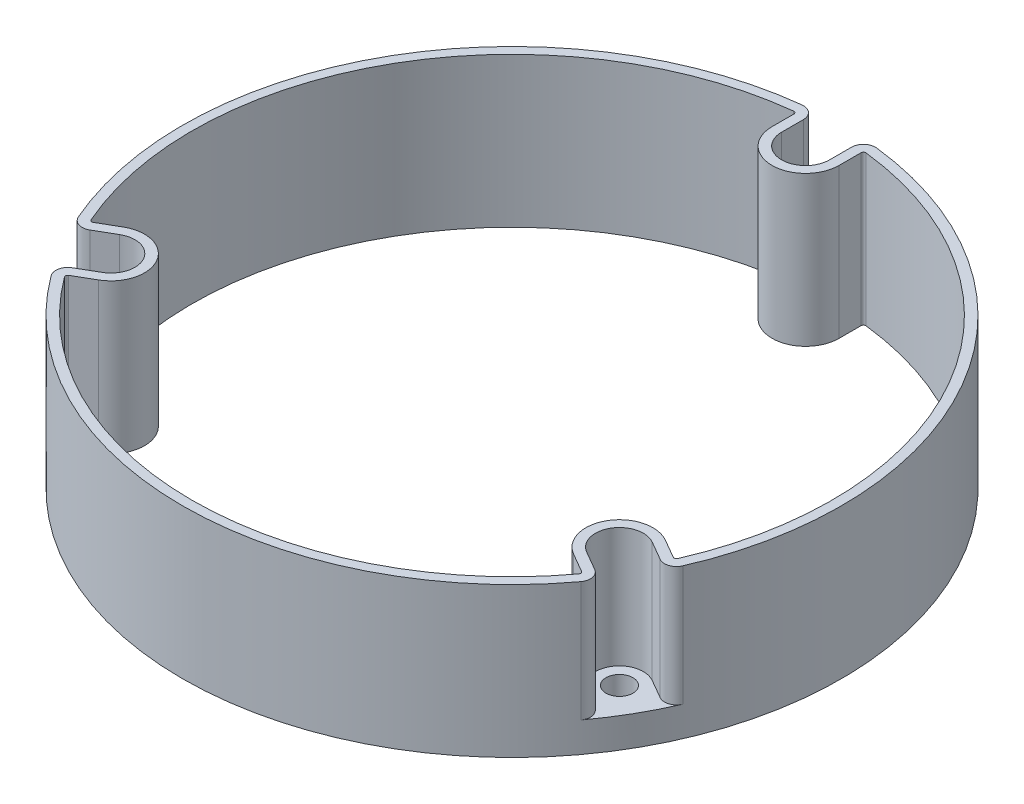
from build123d import *
from build123d.topology import SkipClean

# Parameters (mm, degrees)
EXTRUDE_THIN1_DEPTH = 25
SKETCH3_R           = 2.25
BOSS_EXTRUDE1_DEPTH = 5


with BuildPart() as part:
    # Sketch2 → Extrude-Thin1 (new body)
    with BuildSketch(Plane(origin=(0, 0, 0), x_dir=(1, 0, 0), z_dir=(0, 1, 0))):
        with BuildLine():
            Line((-4, 52.659282183), (-4, 49))
            ThreePointArc((-4, 49), (0, 45), (4, 49))
            Line((4, 49), (4, 52.659282183))
            ThreePointArc((4, 52.659282183), (4.668239922, 54.151399837), (6.226415094, 54.646424907))
            ThreePointArc((6.226415094, 54.646424907), (47.631397208, 27.5), (50.438399742, -21.930978807))
            ThreePointArc((50.438399742, -21.930978807), (49.23060787, -23.032885555), (47.604276115, -22.865539476))
            Line((47.604276115, -22.865539476), (44.435244785, -21.035898385))
            ThreePointArc((44.435244785, -21.035898385), (38.97114317, -22.5), (40.435244785, -27.964101615))
            Line((40.435244785, -27.964101615), (43.604276115, -29.793742707))
            ThreePointArc((43.604276115, -29.793742707), (44.562367948, -31.118514282), (44.211984648, -32.7154461))
            ThreePointArc((44.211984648, -32.7154461), (0, -55), (-44.211984648, -32.715446099))
            ThreePointArc((-44.211984648, -32.715446099), (-44.562367948, -31.118514282), (-43.604276115, -29.793742706))
            Line((-43.604276115, -29.793742706), (-40.435244785, -27.964101615))
            ThreePointArc((-40.435244785, -27.964101615), (-38.97114317, -22.5), (-44.435244785, -21.035898385))
            Line((-44.435244785, -21.035898385), (-47.604276115, -22.865539476))
            ThreePointArc((-47.604276115, -22.865539476), (-49.23060787, -23.032885555), (-50.438399742, -21.930978807))
            ThreePointArc((-50.438399742, -21.930978807), (-47.631397208, 27.5), (-6.226415094, 54.646424907))
            ThreePointArc((-6.226415094, 54.646424907), (-4.668239922, 54.151399837), (-4, 52.659282183))
        make_face()
        with BuildLine():
            Line((-5.6, 52.659282183), (-5.6, 49))
            ThreePointArc((-5.6, 49), (0, 43.4), (5.6, 49))
            Line((5.6, 49), (5.6, 52.659282183))
            ThreePointArc((5.6, 52.659282183), (5.733647984, 52.957705714), (6.045283019, 53.056710728))
            ThreePointArc((6.045283019, 53.056710728), (46.245756562, 26.7), (48.971100841, -21.292986696))
            ThreePointArc((48.971100841, -21.292986696), (48.729542466, -21.513368046), (48.404276115, -21.47989883))
            Line((48.404276115, -21.47989883), (45.235244785, -19.650257739))
            ThreePointArc((45.235244785, -19.650257739), (37.585502524, -21.7), (39.635244785, -29.349742261))
            Line((39.635244785, -29.349742261), (42.804276115, -31.179383353))
            ThreePointArc((42.804276115, -31.179383353), (42.995894482, -31.444337668), (42.925817822, -31.763724031))
            ThreePointArc((42.925817822, -31.763724031), (0, -53.4), (-42.925817822, -31.763724031))
            ThreePointArc((-42.925817822, -31.763724031), (-42.995894482, -31.444337668), (-42.804276115, -31.179383353))
            Line((-42.804276115, -31.179383353), (-39.635244785, -29.349742261))
            ThreePointArc((-39.635244785, -29.349742261), (-37.585502524, -21.7), (-45.235244785, -19.650257739))
            Line((-45.235244785, -19.650257739), (-48.404276115, -21.47989883))
            ThreePointArc((-48.404276115, -21.47989883), (-48.729542466, -21.513368046), (-48.971100841, -21.292986696))
            ThreePointArc((-48.971100841, -21.292986696), (-46.245756562, 26.7), (-6.045283019, 53.056710728))
            ThreePointArc((-6.045283019, 53.056710728), (-5.733647984, 52.957705714), (-5.6, 52.659282183))
        make_face(mode=Mode.SUBTRACT)
    extrude(amount=EXTRUDE_THIN1_DEPTH)

    # Sketch3 → Boss-Extrude1 (add)
    # profile 1 of 3: a face of its own
    with SkipClean():  # the faces are left unmerged after this step: merging them gives an invalid solid
        with BuildSketch(Plane.XZ):
            with BuildLine():
                Line((-43.604276115, 29.793742706), (-40.435244785, 27.964101615))
                ThreePointArc((-40.435244785, 27.964101615), (-38.97114317, 22.5), (-44.435244785, 21.035898385))
                Line((-44.435244785, 21.035898385), (-47.604276115, 22.865539476))
                ThreePointArc((-47.604276115, 22.865539476), (-49.23060787, 23.032885555), (-50.438399742, 21.930978807))
                ThreePointArc((-50.438399742, 21.930978807), (-47.631397208, 27.5), (-44.211984648, 32.715446099))
                ThreePointArc((-44.211984648, 32.715446099), (-44.562367948, 31.118514282), (-43.604276115, 29.793742706))
            make_face()
            with Locations(Location((-42.435244785, 24.5, 0), (0, 0, 270))):
                Circle(SKETCH3_R, mode=Mode.SUBTRACT)
        # profile 2 of 3: a face of its own
        with BuildSketch(Plane.XZ):
            with BuildLine():
                Line((-4, -52.659282183), (-4, -49))
                ThreePointArc((-4, -49), (0, -45), (4, -49))
                Line((4, -49), (4, -52.659282183))
                ThreePointArc((4, -52.659282183), (4.668239922, -54.151399837), (6.226415094, -54.646424907))
                ThreePointArc((6.226415094, -54.646424907), (0, -55), (-6.226415094, -54.646424907))
                ThreePointArc((-6.226415094, -54.646424907), (-4.668239922, -54.151399837), (-4, -52.659282183))
            make_face()
            with Locations(Location((0, -49, 0), (0, 0, 270))):
                Circle(SKETCH3_R, mode=Mode.SUBTRACT)
        # profile 3 of 3: a face of its own
        with BuildSketch(Plane.XZ):
            with BuildLine():
                Line((47.604276115, 22.865539476), (44.435244785, 21.035898385))
                ThreePointArc((44.435244785, 21.035898385), (38.97114317, 22.5), (40.435244785, 27.964101615))
                Line((40.435244785, 27.964101615), (43.604276115, 29.793742707))
                ThreePointArc((43.604276115, 29.793742707), (44.562367948, 31.118514282), (44.211984648, 32.7154461))
                ThreePointArc((44.211984648, 32.7154461), (47.631397208, 27.5), (50.438399742, 21.930978807))
                ThreePointArc((50.438399742, 21.930978807), (49.23060787, 23.032885555), (47.604276115, 22.865539476))
            make_face()
            with Locations(Location((42.435244785, 24.5, 0), (0, 0, 270))):
                Circle(SKETCH3_R, mode=Mode.SUBTRACT)
        extrude(amount=-BOSS_EXTRUDE1_DEPTH)


solid = part.part
